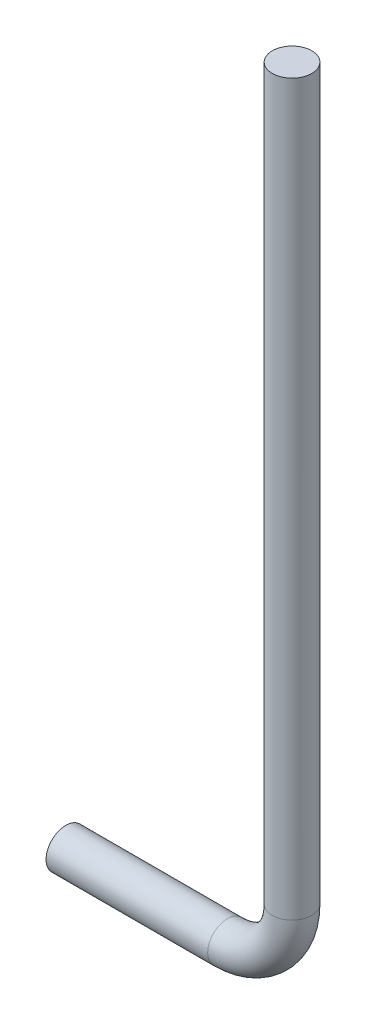
from build123d import *

# Parameters (mm, degrees)
SKETCH2_R           = 3.05
SKETCH3_R           = 3.05
BOSS_EXTRUDE1_DEPTH = 10


with BuildPart() as part:
    # Sweep2: sweep along a path in Sketch1
    with BuildLine(Plane.XY.offset(-5)) as sweep2_path:
        Line((35, 88.3), (35, -14.5))
        ThreePointArc((35, -14.5), (32.071067812, -21.571067812), (25, -24.5))
        Line((25, -24.5), (0, -24.5))
    # Sketch2 → Sweep2 (sweep)
    with BuildSketch(Plane(origin=(0, 88.3, 0), x_dir=(1, 0, 0), z_dir=(0, 1, 0))):
        with Locations((35, 5)):
            Circle(SKETCH2_R)
    sweep(path=sweep2_path.line)

    # Sketch3 → Boss-Extrude1 (add)
    with BuildSketch(Plane(origin=(0, 88.3, 0), x_dir=(1, 0, 0), z_dir=(0, 1, 0))):
        with Locations(Location((35, 5, 0), (0, 0, 270))):
            Circle(SKETCH3_R)
    extrude(amount=BOSS_EXTRUDE1_DEPTH)


solid = part.part
